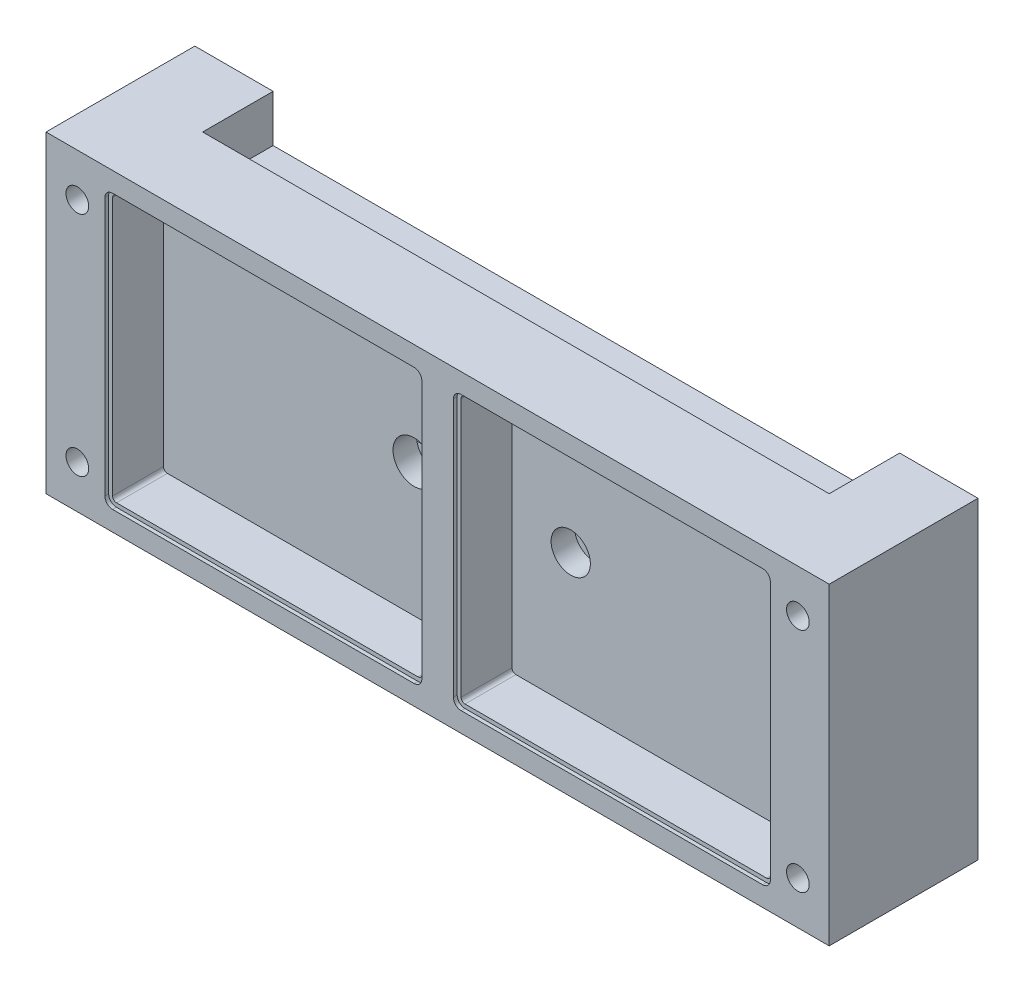
from build123d import *

# Parameters (mm, degrees)
SKETCH1_W           = 100
SKETCH1_H           = 40
BOSS_EXTRUDE1_DEPTH = 38
CUT_EXTRUDE2_START  = -12
SKETCH2_W           = 39.5
SKETCH2_H           = 34
CUT_EXTRUDE2_DEPTH  = 21
CUT_EXTRUDE4_REACH  = 81.36
SKETCH4_R           = 1.45
SKETCH6_W           = 100
SKETCH6_H           = 19
CUT_EXTRUDE5_DEPTH  = 87.215210375
FILLET1_R           = 0.5
CUT_EXTRUDE6_START  = 6.5
CUT_EXTRUDE6_DEPTH  = 0.5
CUT_EXTRUDE6_TAPER  = 2
CUT_EXTRUDE7_START  = 6.5
CUT_EXTRUDE7_DEPTH  = 0.5
CUT_EXTRUDE7_TAPER  = 2
CUT_EXTRUDE12_DEPTH = 9
CUT_EXTRUDE13_REACH = 72.385
SKETCH18_R          = 2.506862912
SKETCH18_R_2        = 2.693115416
SKETCH19_R          = 6.477
SKETCH19_R_2        = 4.572
CUT_EXTRUDE14_DEPTH = 0.79375
SKETCH21_W          = 10
SKETCH21_H          = 15
CUT_EXTRUDE15_DEPTH = 9
SKETCH22_W          = 4
SKETCH22_H          = 2.5
CUT_EXTRUDE16_DEPTH = 90
SKETCH23_W          = 80
SKETCH23_H          = 6
CUT_EXTRUDE17_DEPTH = 9


with BuildPart() as part:
    # Sketch1 → Boss-Extrude1 (new body)
    with BuildSketch(Plane.XY):
        with Locations((16.25, 1.5625)):
            Rectangle(SKETCH1_W, SKETCH1_H)
    extrude(amount=BOSS_EXTRUDE1_DEPTH)

    # Sketch2 → Cut-Extrude2 (cut)
    with BuildSketch(Plane(origin=(0, 0, 0), x_dir=(-1, 0, 0), z_dir=(0, 0, -1)).offset(CUT_EXTRUDE2_START)):
        with Locations((-38.5, 1.5625)):
            Rectangle(SKETCH2_W, SKETCH2_H)
        with Locations((6, 1.5625)):
            Rectangle(SKETCH2_W, SKETCH2_H)
    extrude(amount=-CUT_EXTRUDE2_DEPTH, mode=Mode.SUBTRACT)

    # Sketch4 → Cut-Extrude4 (cut, up to next)
    with BuildSketch(Plane(origin=(0, 0, 0), x_dir=(-1, 0, 0), z_dir=(0, 0, -1)), mode=Mode.PRIVATE) as cut_extrude4_sk1:
        with Locations((-62.25, 16.0625)):
            Circle(SKETCH4_R)
    cut_extrude4_tool1 = extrude(cut_extrude4_sk1.sketch, amount=-CUT_EXTRUDE4_REACH, mode=Mode.PRIVATE) & part.part
    # Sketch4 → Cut-Extrude4 (cut, up to next)
    with BuildSketch(Plane(origin=(0, 0, 0), x_dir=(-1, 0, 0), z_dir=(0, 0, -1)), mode=Mode.PRIVATE) as cut_extrude4_sk2:
        with Locations((-62.25, -12.9375)):
            Circle(SKETCH4_R)
    cut_extrude4_tool2 = extrude(cut_extrude4_sk2.sketch, amount=-CUT_EXTRUDE4_REACH, mode=Mode.PRIVATE) & part.part
    # Sketch4 → Cut-Extrude4 (cut, up to next)
    with BuildSketch(Plane(origin=(0, 0, 0), x_dir=(-1, 0, 0), z_dir=(0, 0, -1)), mode=Mode.PRIVATE) as cut_extrude4_sk3:
        with Locations((29.75, 16.0625)):
            Circle(SKETCH4_R)
    cut_extrude4_tool3 = extrude(cut_extrude4_sk3.sketch, amount=-CUT_EXTRUDE4_REACH, mode=Mode.PRIVATE) & part.part
    # Sketch4 → Cut-Extrude4 (cut, up to next)
    with BuildSketch(Plane(origin=(0, 0, 0), x_dir=(-1, 0, 0), z_dir=(0, 0, -1)), mode=Mode.PRIVATE) as cut_extrude4_sk4:
        with Locations((29.75, -12.9375)):
            Circle(SKETCH4_R)
    cut_extrude4_tool4 = extrude(cut_extrude4_sk4.sketch, amount=-CUT_EXTRUDE4_REACH, mode=Mode.PRIVATE) & part.part
    add(cut_extrude4_tool1.solids().sort_by_distance((62.25, 16.0625, 0))[0], mode=Mode.SUBTRACT)
    add(cut_extrude4_tool2.solids().sort_by_distance((62.25, -12.9375, 0))[0], mode=Mode.SUBTRACT)
    add(cut_extrude4_tool3.solids().sort_by_distance((-29.75, 16.0625, 0))[0], mode=Mode.SUBTRACT)
    add(cut_extrude4_tool4.solids().sort_by_distance((-29.75, -12.9375, 0))[0], mode=Mode.SUBTRACT)

    # Sketch6 → Cut-Extrude5 (cut, through all)
    with BuildSketch(Plane(origin=(0, 21.5625, 0), x_dir=(1, 0, 0), z_dir=(0, 1, 0))):
        with Locations((16.25, -28.5)):
            Rectangle(SKETCH6_W, SKETCH6_H)
    extrude(amount=-CUT_EXTRUDE5_DEPTH, mode=Mode.SUBTRACT)

    # Fillet1
    fillet1_edges = [part.edges().sort_by_distance(p)[0] for p in [
        (-25.75, -15.4375, 15.5),
        (13.75, -15.4375, 15.5),
        (-25.75, 18.5625, 15.5),
        (13.75, 18.5625, 15.5),
        (18.75, -15.4375, 15.5),
        (58.25, -15.4375, 15.5),
        (18.75, 18.5625, 15.5),
        (58.25, 18.5625, 15.5),
    ]]
    fillet(fillet1_edges, radius=FILLET1_R)

    # Sketch10 → Cut-Extrude6 (cut)
    with BuildSketch(Plane.XY.offset(12).offset(CUT_EXTRUDE6_START)):
        with BuildLine():
            Line((14.25, -14.9375), (14.25, 18.0625))
            ThreePointArc((14.25, 18.0625), (13.957106781, 18.769606781), (13.25, 19.0625))
            Line((13.25, 19.0625), (-25.25, 19.0625))
            ThreePointArc((-25.25, 19.0625), (-25.957106781, 18.769606781), (-26.25, 18.0625))
            Line((-26.25, 18.0625), (-26.25, -14.9375))
            ThreePointArc((-26.25, -14.9375), (-25.957106781, -15.644606781), (-25.25, -15.9375))
            Line((-25.25, -15.9375), (13.25, -15.9375))
            ThreePointArc((13.25, -15.9375), (13.957106781, -15.644606781), (14.25, -14.9375))
        make_face()
    extrude(amount=CUT_EXTRUDE6_DEPTH, taper=CUT_EXTRUDE6_TAPER, mode=Mode.SUBTRACT)

    # Sketch11 → Cut-Extrude7 (cut)
    with BuildSketch(Plane.XY.offset(12).offset(CUT_EXTRUDE7_START)):
        with BuildLine():
            Line((58.75, -14.9375), (58.75, 18.0625))
            ThreePointArc((58.75, 18.0625), (58.457106781, 18.769606781), (57.75, 19.0625))
            Line((57.75, 19.0625), (19.25, 19.0625))
            ThreePointArc((19.25, 19.0625), (18.542893219, 18.769606781), (18.25, 18.0625))
            Line((18.25, 18.0625), (18.25, -14.9375))
            ThreePointArc((18.25, -14.9375), (18.542893219, -15.644606781), (19.25, -15.9375))
            Line((19.25, -15.9375), (57.75, -15.9375))
            ThreePointArc((57.75, -15.9375), (58.457106781, -15.644606781), (58.75, -14.9375))
        make_face()
    extrude(amount=CUT_EXTRUDE7_DEPTH, taper=CUT_EXTRUDE7_TAPER, mode=Mode.SUBTRACT)

    # Sketch17 → Cut-Extrude12 (cut)
    with BuildSketch(Plane(origin=(0, 0, 0), x_dir=(-1, 0, 0), z_dir=(0, 0, -1))):
        with BuildLine():
            Line((-56.25, 9.0625), (23.75, 9.0625))
            ThreePointArc((23.75, 9.0625), (31.25, 1.5625), (23.75, -5.9375))
            Line((23.75, -5.9375), (-56.25, -5.9375))
            ThreePointArc((-56.25, -5.9375), (-63.75, 1.5625), (-56.25, 9.0625))
        make_face()
    extrude(amount=-CUT_EXTRUDE12_DEPTH, mode=Mode.SUBTRACT)

    # Sketch18 → Cut-Extrude13 (cut, up to next)
    with BuildSketch(Plane(origin=(0, 0, 9), x_dir=(-1, 0, 0), z_dir=(0, 0, -1)), mode=Mode.PRIVATE) as cut_extrude13_sk1:
        with Locations((-26.25, 1.5625)):
            Circle(SKETCH18_R)
    cut_extrude13_tool1 = extrude(cut_extrude13_sk1.sketch, amount=-CUT_EXTRUDE13_REACH, mode=Mode.PRIVATE) & part.part
    # Sketch18 → Cut-Extrude13 (cut, up to next)
    with BuildSketch(Plane(origin=(0, 0, 9), x_dir=(-1, 0, 0), z_dir=(0, 0, -1)), mode=Mode.PRIVATE) as cut_extrude13_sk2:
        with Locations((-6.25, 1.5625)):
            Circle(SKETCH18_R_2)
    cut_extrude13_tool2 = extrude(cut_extrude13_sk2.sketch, amount=-CUT_EXTRUDE13_REACH, mode=Mode.PRIVATE) & part.part
    add(cut_extrude13_tool1.solids().sort_by_distance((26.25, 1.5625, 9))[0], mode=Mode.SUBTRACT)
    add(cut_extrude13_tool2.solids().sort_by_distance((6.25, 1.5625, 9))[0], mode=Mode.SUBTRACT)

    # Sketch19 → Cut-Extrude14 (cut)
    # profile 1 of 2: a face of its own
    with BuildSketch(Plane(origin=(0, 0, 9), x_dir=(-1, 0, 0), z_dir=(0, 0, -1))):
        with Locations((-26.25, 1.5625)):
            Circle(SKETCH19_R)
        with Locations((-26.25, 1.5625)):
            Circle(SKETCH19_R_2, mode=Mode.SUBTRACT)
    # profile 2 of 2: a face of its own
    with BuildSketch(Plane(origin=(0, 0, 9), x_dir=(-1, 0, 0), z_dir=(0, 0, -1))):
        with Locations((-6.25, 1.5625)):
            Circle(SKETCH19_R)
        with Locations((-6.25, 1.5625)):
            Circle(SKETCH19_R_2, mode=Mode.SUBTRACT)
    extrude(amount=-CUT_EXTRUDE14_DEPTH, mode=Mode.SUBTRACT)

    # Sketch21 → Cut-Extrude15 (cut)
    with BuildSketch(Plane(origin=(0, 0, 0), x_dir=(-1, 0, 0), z_dir=(0, 0, -1))):
        with Locations((28.75, 1.5625)):
            Rectangle(SKETCH21_W, SKETCH21_H)
    extrude(amount=-CUT_EXTRUDE15_DEPTH, mode=Mode.SUBTRACT)

    # Sketch22 → Cut-Extrude16 (cut)
    with BuildSketch(Plane.ZY.offset(33.75)):
        with Locations((4, 10.3125)):
            Rectangle(SKETCH22_W, SKETCH22_H)
        with Locations((4, -7.1875)):
            Rectangle(SKETCH22_W, SKETCH22_H)
    extrude(amount=-CUT_EXTRUDE16_DEPTH, mode=Mode.SUBTRACT)

    # Sketch23 → Cut-Extrude17 (cut)
    with BuildSketch(Plane(origin=(0, 0, 0), x_dir=(-1, 0, 0), z_dir=(0, 0, -1))):
        with Locations((-16.25, 18.5625)):
            Rectangle(SKETCH23_W, SKETCH23_H)
        with Locations((-16.25, -15.4375)):
            Rectangle(SKETCH23_W, SKETCH23_H)
    extrude(amount=-CUT_EXTRUDE17_DEPTH, mode=Mode.SUBTRACT)


solid = part.part
